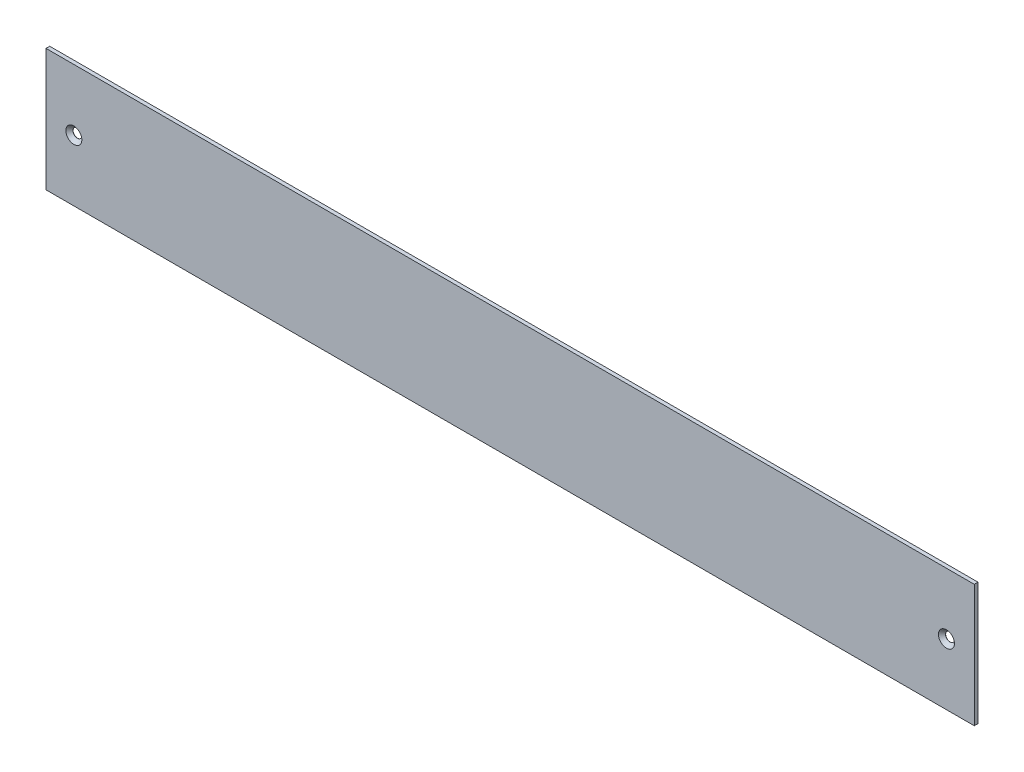
from build123d import *

# Parameters (mm, degrees)
AUFSATZ_LINEAR_AUSTRAGEN1_DEPTH             = 2
FORMSENKUNG_F_R_M4_SENKSCHRAUBE_MIT_2_COUNT = 2
FORMSENKUNG_F_R_M4_SENKSCHRAUBE_MIT_2_PITCH = 470
SKIZZE5_W                                   = 500
SKIZZE5_H                                   = 8
SCHLITZ_OBEN_DEPTH                          = 10


with BuildPart() as part:
    # Skizze1 → Aufsatz-Linear austragen1 (new body)
    with BuildSketch(Plane.XY):
        Polygon((-339.903846154, 3), (160.096153846, 3), (160.096153846, -63), (130.095509739, -63), (130.095509739, -71), (-309.903846154, -71), (-309.903846154, -63), (-339.903846154, -63), align=None)
    extrude(amount=AUFSATZ_LINEAR_AUSTRAGEN1_DEPTH)

    # Skizze3 → Formsenkung für M4 Senkschraube mit Innensechskant1 (revolve, cut)
    with BuildSketch(Plane(origin=(145.096153846, -30, 2), x_dir=(0, -1, 0), z_dir=(1, 0, 0))):
        Polygon((0, 0), (0, 2), (2.4, 2), (2.4, 1.9), (4.3, 0), align=None)
    formsenkung_f_r_m4_senkschraube_mit_inne = revolve(axis=Axis((145.096153846, -30, 8.35), (0, 0, -1)), mode=Mode.SUBTRACT)

    # Formsenkung f_r M4 Senkschraube mit  2: Formsenkung für M4 Senkschraube mit Innensechskant1 ×2
    with Locations(*[(-i * FORMSENKUNG_F_R_M4_SENKSCHRAUBE_MIT_2_PITCH, 0, 0) for i in range(1, FORMSENKUNG_F_R_M4_SENKSCHRAUBE_MIT_2_COUNT)]):
        add(formsenkung_f_r_m4_senkschraube_mit_inne, mode=Mode.SUBTRACT)

    # Skizze5 → Schlitz Oben (cut)
    with BuildSketch(Plane(origin=(0, 0, 0), x_dir=(-1, 0, 0), z_dir=(0, 0, -1))):
        with Locations((89.903846154, -67)):
            Rectangle(SKIZZE5_W, SKIZZE5_H)
    extrude(amount=-SCHLITZ_OBEN_DEPTH, mode=Mode.SUBTRACT)


solid = part.part
